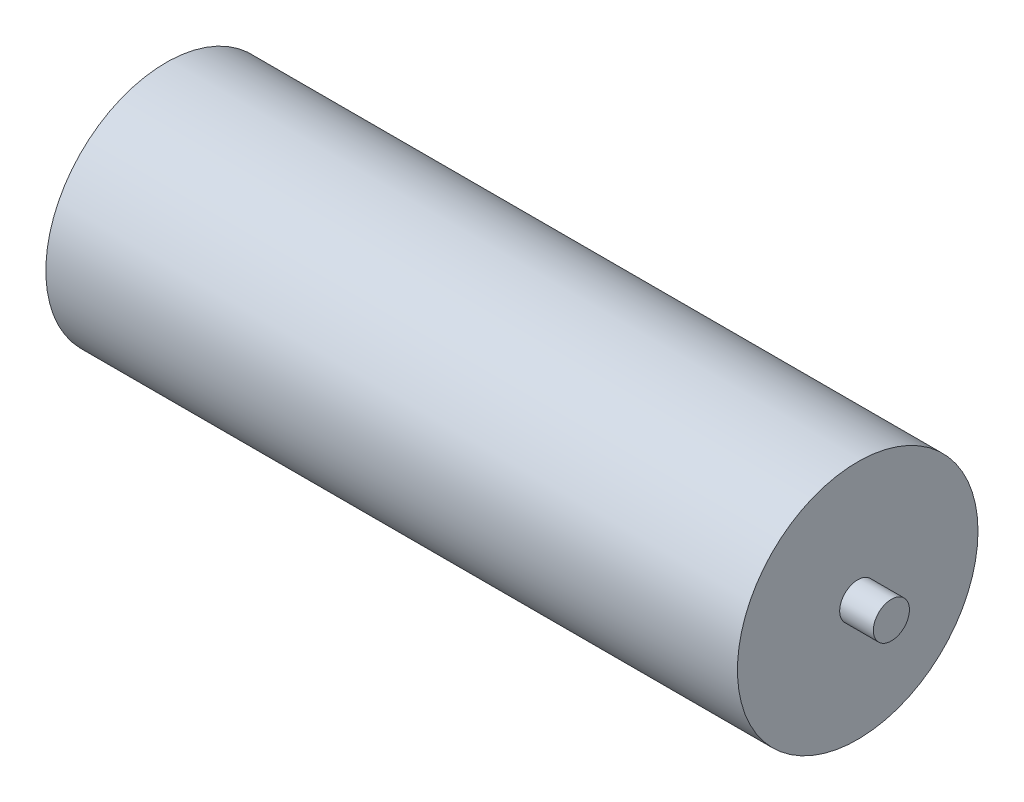
from build123d import *

# Parameters (mm, degrees)
SKETCH1_R           = 25.4
BOSS_EXTRUDE1_DEPTH = 146.05
SKETCH2_R           = 3.81
BOSS_EXTRUDE2_DEPTH = 7.112


with BuildPart() as part:
    # Sketch1 → Boss-Extrude1 (new body)
    with BuildSketch(Plane(origin=(0, 0, 0), x_dir=(0, 0, -1), z_dir=(1, 0, 0))):
        Circle(SKETCH1_R)
    extrude(amount=BOSS_EXTRUDE1_DEPTH)

    # Sketch2 → Boss-Extrude2 (add)
    with BuildSketch(Plane(origin=(146.05, 0, 0), x_dir=(0, 0, -1), z_dir=(1, 0, 0))):
        with Locations(Location((0, 0, 0), (0, 0, 180))):
            Circle(SKETCH2_R)
    extrude(amount=BOSS_EXTRUDE2_DEPTH)


solid = part.part
